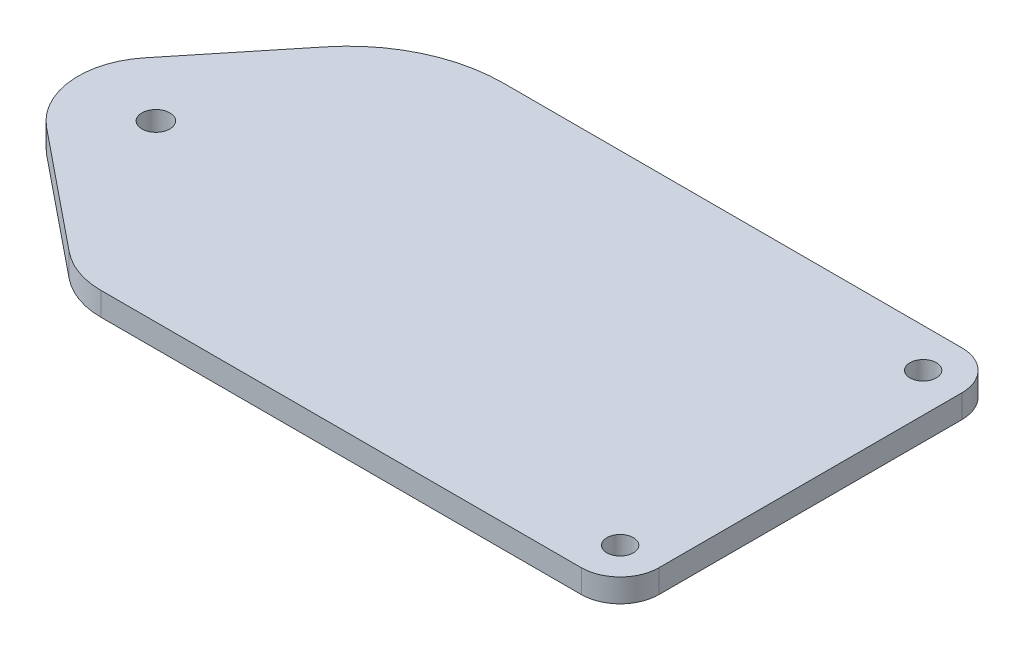
from build123d import *

# Parameters (mm, degrees)
SKETCH1_R           = 1.7
BOSS_EXTRUDE2_DEPTH = 3
BOSS_EXTRUDE3_DEPTH = 3
SKETCH4_R           = 1.8
CUT_EXTRUDE1_DEPTH  = 5


with BuildPart() as part:
    # Sketch1 → Boss-Extrude2 (new body)
    with BuildSketch(Plane(origin=(0, 0, 0), x_dir=(1, 0, 0), z_dir=(0, 1, 0))):
        with BuildLine():
            Line((-39.007261737, -39.092855818), (22.832898339, -39.092855818))
            ThreePointArc((22.832898339, -39.092855818), (26.368432245, -37.628389724), (27.832898339, -34.092855818))
            Line((27.832898339, -34.092855818), (27.832898339, 4.907144182))
            ThreePointArc((27.832898339, 4.907144182), (26.368432245, 8.442678088), (22.832898339, 9.907144182))
            Line((22.832898339, 9.907144182), (-36.143461968, 9.907144182))
            ThreePointArc((-36.143461968, 9.907144182), (-44.75263802, 7.959348694), (-51.684922644, 2.495352954))
            Line((-51.684922644, 2.495352954), (-62.112298102, -10.378332935))
            ThreePointArc((-62.112298102, -10.378332935), (-64.286907773, -17.716569545), (-60.63567215, -24.443167658))
            Line((-60.63567215, -24.443167658), (-45.301366123, -36.863586155))
            ThreePointArc((-45.301366123, -36.863586155), (-42.345876466, -38.519077314), (-39.007261737, -39.092855818))
        make_face()
        with Locations(Location((22.832898339, 4.907144182, 0), (0, 0, 270))):
            Circle(SKETCH1_R, mode=Mode.SUBTRACT)
        with Locations(Location((22.832898339, -34.092855818, 0), (0, 0, 270))):
            Circle(SKETCH1_R, mode=Mode.SUBTRACT)
    extrude(amount=BOSS_EXTRUDE2_DEPTH)

    # Sketch3 → Boss-Extrude3 (add)
    with BuildSketch(Plane.XZ):
        with BuildLine():
            ThreePointArc((-41.216654954, -6.9270495), (-41.923761735, -6.634156281), (-42.216654954, -5.9270495))
            Line((-42.216654954, -5.9270495), (-42.216654954, 35.0729505))
            ThreePointArc((-42.216654954, 35.0729505), (-41.923761735, 35.780057281), (-41.216654954, 36.0729505))
            Line((-41.216654954, 36.0729505), (18.783345046, 36.0729505))
            ThreePointArc((18.783345046, 36.0729505), (19.490451827, 35.780057281), (19.783345046, 35.0729505))
            Line((19.783345046, 35.0729505), (19.783345046, -5.9270495))
            ThreePointArc((19.783345046, -5.9270495), (19.490451827, -6.634156281), (18.783345046, -6.9270495))
            Line((18.783345046, -6.9270495), (-41.216654954, -6.9270495))
        make_face()
    extrude(amount=BOSS_EXTRUDE3_DEPTH)

    # Sketch4 → Cut-Extrude1 (cut)
    with BuildSketch(Plane(origin=(0, 3, 0), x_dir=(1, 0, 0), z_dir=(0, 1, 0))):
        with Locations(Location((-54.341567764, -16.672437321, 0), (0, 0, 270))):
            Circle(SKETCH4_R)
    extrude(amount=-CUT_EXTRUDE1_DEPTH, mode=Mode.SUBTRACT)


solid = part.part
